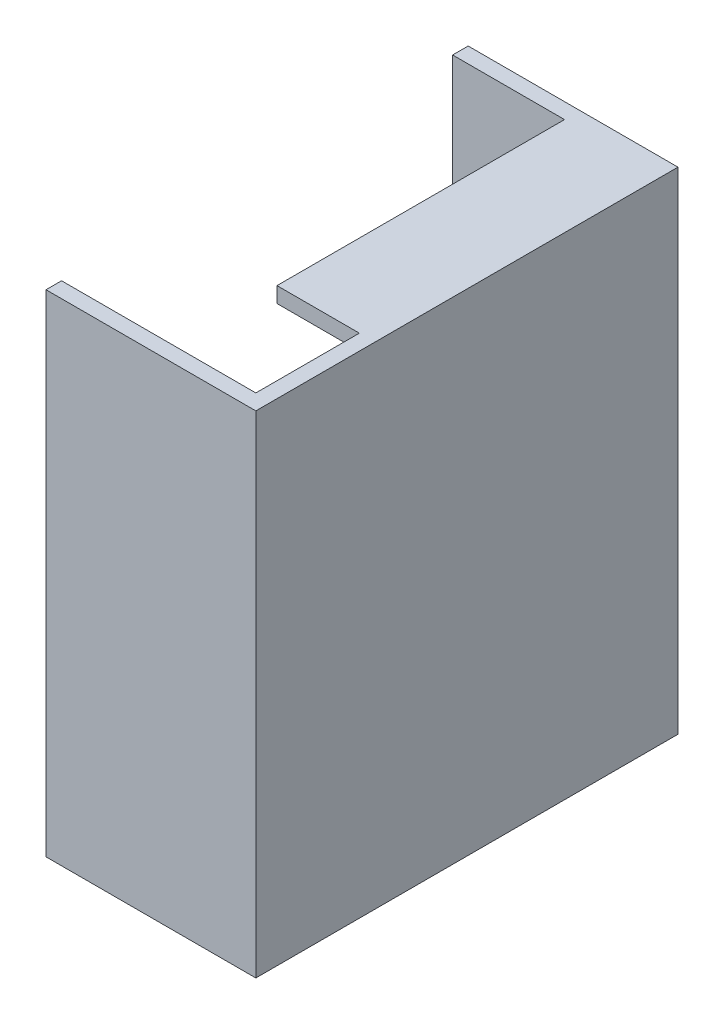
from build123d import *

# Parameters (mm, degrees)
SKETCH1_W           = 68.987924
SKETCH1_H           = 80.264
BOSS_EXTRUDE3_DEPTH = 2.54
BOSS_EXTRUDE4_DEPTH = 31.75
SKETCH1_6_W         = 46.99
SKETCH1_6_H         = 2.54
BOSS_EXTRUDE5_DEPTH = 13.462
SKETCH2_W           = 2.54
SKETCH2_H           = 31.75
BOSS_EXTRUDE6_DEPTH = 34.29
BOSS_EXTRUDE7_DEPTH = 31.75


with BuildPart() as part:
    # Sketch1 → Boss-Extrude3 (new body)
    with BuildSketch(Plane(origin=(0, 0, 0), x_dir=(0, 0, -1), z_dir=(1, 0, 0))):
        with Locations((0.050038, -1.397)):
            Rectangle(SKETCH1_W, SKETCH1_H)
    extrude(amount=BOSS_EXTRUDE3_DEPTH)

    # Sketch1<5> → Boss-Extrude4 (add)
    with BuildSketch(Plane(origin=(0, 0, 0), x_dir=(0, 0, -1), z_dir=(1, 0, 0))):
        Polygon((34.544, 38.735), (32.004, 38.735), (32.004, 36.195), (32.004, -38.989), (-31.903924, -38.989), (-31.903924, 38.735), (-34.443924, 38.735), (-34.443924, 32.385), (-34.443924, -41.529), (34.544, -41.529), align=None)
    extrude(amount=-BOSS_EXTRUDE4_DEPTH)

    # Sketch1<6> → Boss-Extrude5 (add)
    with BuildSketch(Plane(origin=(0, 0, 0), x_dir=(0, 0, -1), z_dir=(1, 0, 0))):
        with Locations((8.509, 37.465)):
            Rectangle(SKETCH1_6_W, SKETCH1_6_H)
    extrude(amount=-BOSS_EXTRUDE5_DEPTH)

    # Sketch2 → Boss-Extrude6 (add)
    with BuildSketch(Plane.ZY):
        with Locations((17.526, -16.764)):
            Rectangle(SKETCH2_W, SKETCH2_H)
    extrude(amount=BOSS_EXTRUDE6_DEPTH)

    # Sketch3 → Boss-Extrude7 (add)
    with BuildSketch(Plane.XZ.offset(32.639)):
        with BuildLine():
            Line((-34.29, 18.796), (-40.086328026, 18.796))
            ThreePointArc((-40.086328026, 18.796), (-40.695965663, 18.338670907), (-40.427477229, 17.625423468))
            Line((-40.427477229, 17.625423468), (-34.29, 13.716))
            Line((-34.29, 13.716), (-34.29, 18.796))
        make_face()
    extrude(amount=-BOSS_EXTRUDE7_DEPTH)


solid = part.part
